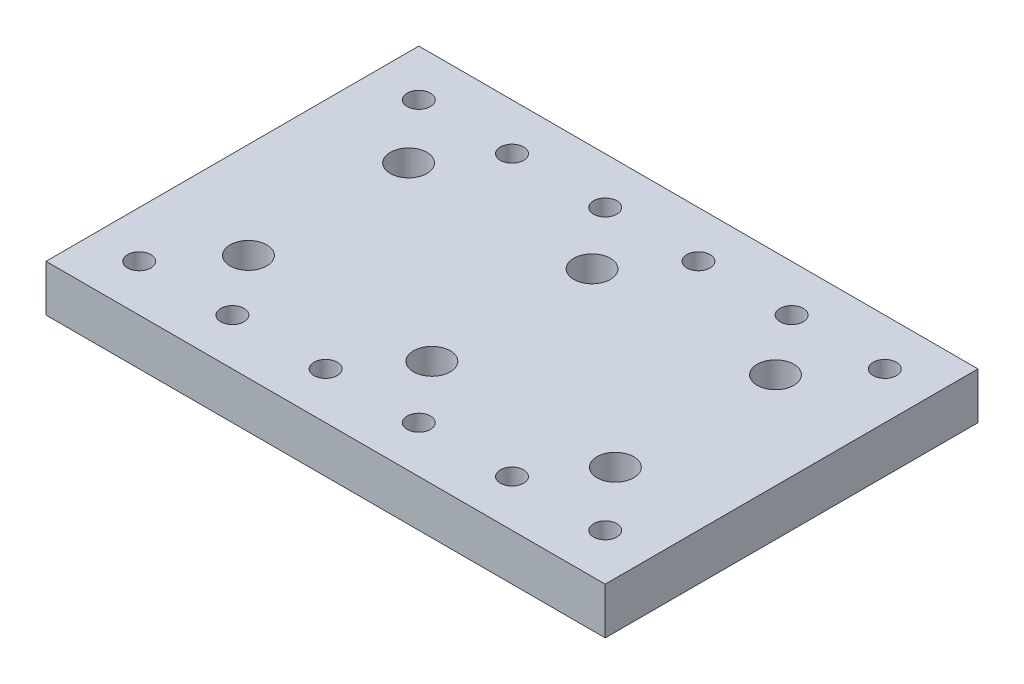
from build123d import *

# Parameters (mm, degrees)
SKETCH1_W           = 152.4
SKETCH1_H           = 101.6
BOSS_EXTRUDE1_DEPTH = 12.7
SKETCH2_R           = 5
CUT_EXTRUDE1_DEPTH  = 12.7
SKETCH3_R           = 3.175
CUT_EXTRUDE2_DEPTH  = 93.457395594


with BuildPart() as part:
    # Sketch1 → Boss-Extrude1 (new body)
    with BuildSketch(Plane(origin=(0, 0, 0), x_dir=(1, 0, 0), z_dir=(0, 1, 0))):
        Rectangle(SKETCH1_W, SKETCH1_H)
    extrude(amount=BOSS_EXTRUDE1_DEPTH)

    # Sketch2 → Cut-Extrude1 (cut)
    with BuildSketch(Plane.XZ):
        with Locations(Location((-50.004206057, 21.825, 0), (0, 0, 270))):
            Circle(SKETCH2_R)
        with Locations(Location((-50.004206057, -21.825, 0), (0, 0, 270))):
            Circle(SKETCH2_R)
        with Locations(Location((-0.004206057, 21.825, 0), (0, 0, 270))):
            Circle(SKETCH2_R)
        with Locations(Location((-0.004206057, -21.825, 0), (0, 0, 270))):
            Circle(SKETCH2_R)
        with Locations(Location((49.995793943, 21.825, 0), (0, 0, 270))):
            Circle(SKETCH2_R)
        with Locations(Location((49.995793943, -21.825, 0), (0, 0, 270))):
            Circle(SKETCH2_R)
    extrude(amount=-CUT_EXTRUDE1_DEPTH, mode=Mode.SUBTRACT)

    # Sketch3 → Cut-Extrude2 (cut, through all)
    with BuildSketch(Plane(origin=(0, 12.7, 0), x_dir=(1, 0, 0), z_dir=(0, 1, 0))):
        with Locations(Location((-63.5, -38.1, 0), (0, 0, 270))):
            Circle(SKETCH3_R)
        with Locations(Location((-38.1, -38.1, 0), (0, 0, 270))):
            Circle(SKETCH3_R)
        with Locations(Location((-12.7, -38.1, 0), (0, 0, 270))):
            Circle(SKETCH3_R)
        with Locations(Location((12.7, -38.1, 0), (0, 0, 270))):
            Circle(SKETCH3_R)
        with Locations(Location((38.1, -38.1, 0), (0, 0, 270))):
            Circle(SKETCH3_R)
        with Locations(Location((63.5, -38.1, 0), (0, 0, 270))):
            Circle(SKETCH3_R)
        with Locations(Location((-38.1, 38.1, 0), (0, 0, 270))):
            Circle(SKETCH3_R)
        with Locations(Location((-12.7, 38.1, 0), (0, 0, 270))):
            Circle(SKETCH3_R)
        with Locations(Location((12.7, 38.1, 0), (0, 0, 270))):
            Circle(SKETCH3_R)
        with Locations(Location((38.1, 38.1, 0), (0, 0, 270))):
            Circle(SKETCH3_R)
        with Locations(Location((63.5, 38.1, 0), (0, 0, 270))):
            Circle(SKETCH3_R)
        with Locations(Location((-63.5, 38.1, 0), (0, 0, 270))):
            Circle(SKETCH3_R)
    extrude(amount=-CUT_EXTRUDE2_DEPTH, mode=Mode.SUBTRACT)


solid = part.part
